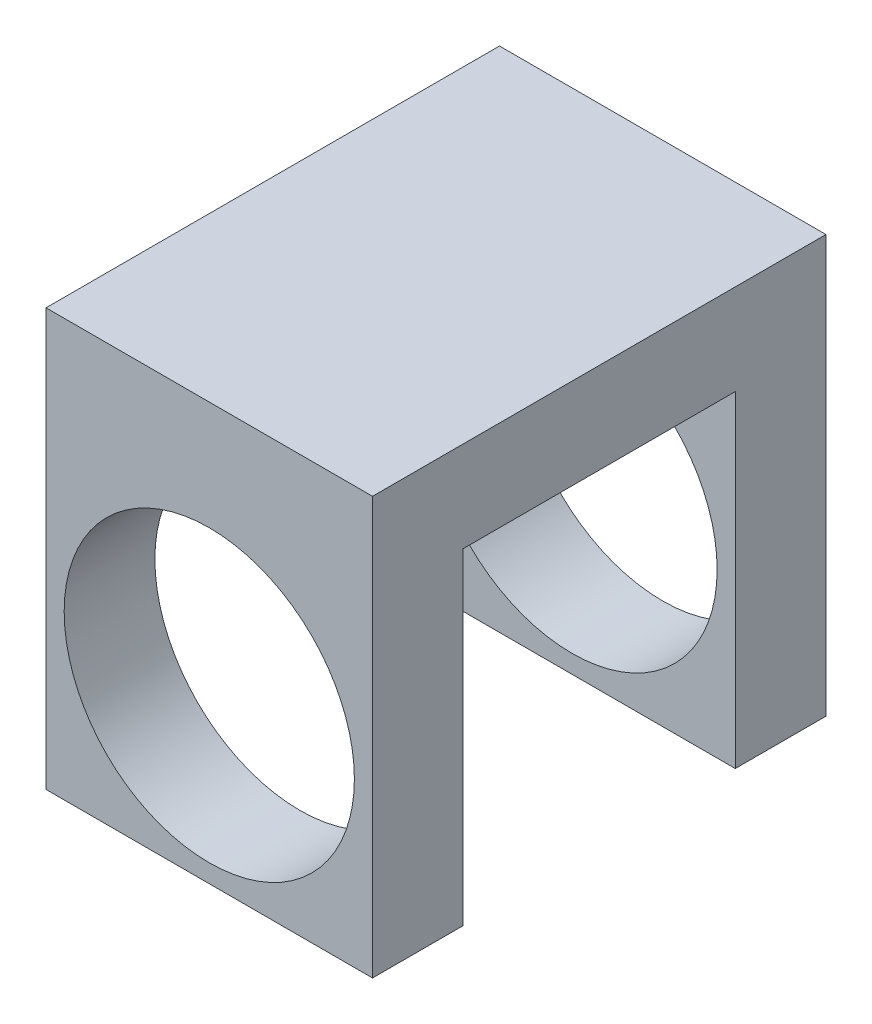
from build123d import *

# Parameters (mm, degrees)
SKETCH_1_W          = 18
SKETCH_1_H          = 18
EXTRUDE_1_DEPTH     = 5
SKETCH_2_R          = 8
CUT_EXTRUDE_1_DEPTH = 5
SKETCH_3_W          = 18
SKETCH_3_H          = 25
EXTRUDE_2_DEPTH     = 5
SKETCH_4_W          = 18
SKETCH_4_H          = 5
EXTRUDE_3_DEPTH     = 18
SKETCH_5_R          = 8
CUT_EXTRUDE_2_DEPTH = 18


with BuildPart() as part:
    # 草图1 → 凸台-拉伸1 (new body)
    with BuildSketch(Plane.XY):
        Rectangle(SKETCH_1_W, SKETCH_1_H)
    extrude(amount=EXTRUDE_1_DEPTH)

    # 草图2 → 切除-拉伸1 (cut)
    with BuildSketch(Plane.XY.offset(5)):
        Circle(SKETCH_2_R)
    extrude(amount=-CUT_EXTRUDE_1_DEPTH, mode=Mode.SUBTRACT)

    # 草图3 → 凸台-拉伸2 (add)
    with BuildSketch(Plane(origin=(0, 9, 0), x_dir=(1, 0, 0), z_dir=(0, 1, 0))):
        with Locations((0, 7.5)):
            Rectangle(SKETCH_3_W, SKETCH_3_H)
    extrude(amount=EXTRUDE_2_DEPTH)

    # 草图4 → 凸台-拉伸3 (add)
    with BuildSketch(Plane.XZ.offset(-9)):
        with Locations((0, -17.5)):
            Rectangle(SKETCH_4_W, SKETCH_4_H)
    extrude(amount=EXTRUDE_3_DEPTH)

    # 草图5 → 切除-拉伸2 (cut)
    with BuildSketch(Plane.XY.offset(-15)):
        Circle(SKETCH_5_R)
    extrude(amount=-CUT_EXTRUDE_2_DEPTH, mode=Mode.SUBTRACT)


solid = part.part
